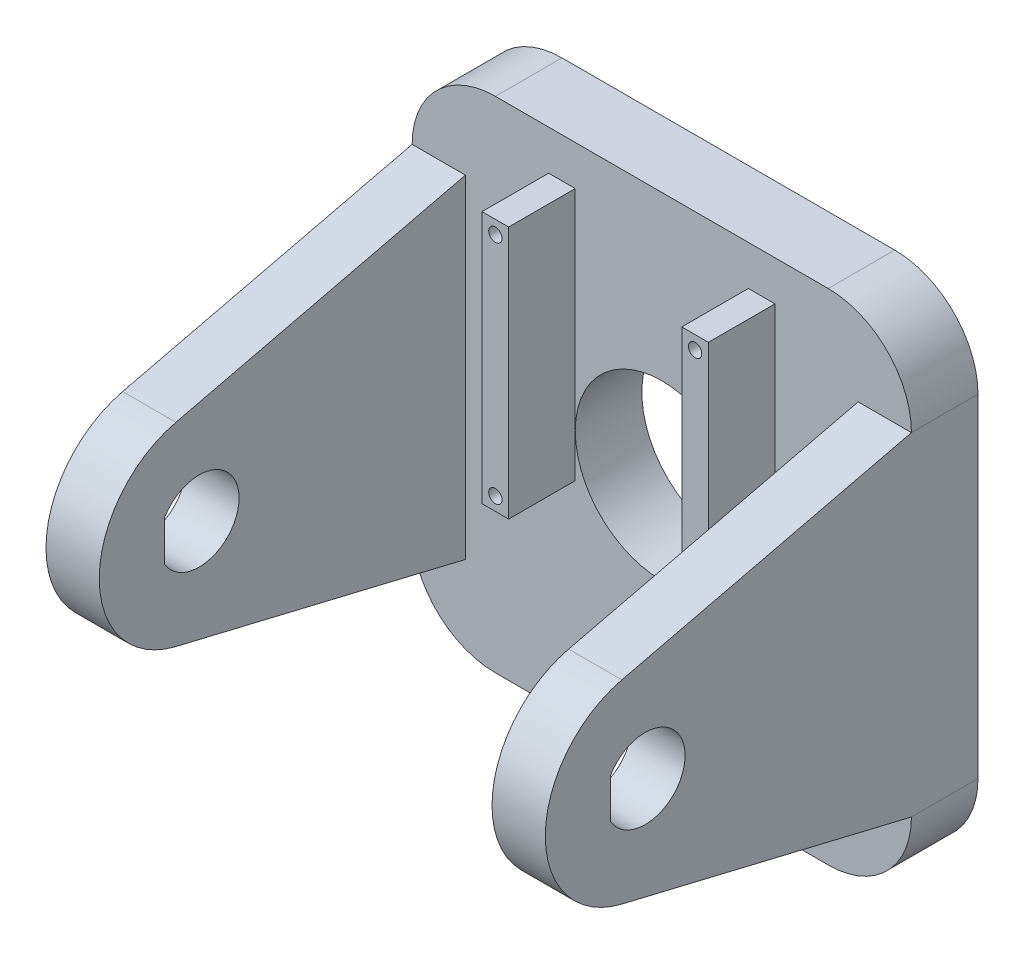
from build123d import *

# Parameters (mm, degrees)
BOSS_EXTRUDE1_DEPTH = 10
BOSS_EXTRUDE2_DEPTH = 8
SKETCH4_R           = 13
CUT_EXTRUDE2_DEPTH  = 77.40353395
SKETCH5_W           = 4
SKETCH5_H           = 38
SKETCH5_R           = 1
BOSS_EXTRUDE3_DEPTH = 10


with BuildPart() as part:
    # Sketch1 → Boss-Extrude1 (new body)
    with BuildSketch(Plane(origin=(0, 0, 0), x_dir=(0, 1, 0), z_dir=(0, 0, 1))):
        with BuildLine():
            Line((-25, -37.5), (25, -37.5))
            ThreePointArc((25, -37.5), (33.838834765, -33.838834765), (37.5, -25))
            Line((37.5, -25), (37.5, 25))
            ThreePointArc((37.5, 25), (33.838834765, 33.838834765), (25, 37.5))
            Line((25, 37.5), (-25, 37.5))
            ThreePointArc((-25, 37.5), (-33.838834765, 33.838834765), (-37.5, 25))
            Line((-37.5, 25), (-37.5, -25))
            ThreePointArc((-37.5, -25), (-33.838834765, -33.838834765), (-25, -37.5))
        make_face()
    extrude(amount=BOSS_EXTRUDE1_DEPTH)

    # Sketch2 → Boss-Extrude2 (add)
    with BuildSketch(Plane.YZ.offset(37.5)):
        with BuildLine():
            ThreePointArc((14.587782351, 53.492363969), (0, 65), (-14.587782351, 53.492363969))
            Line((-14.587782351, 53.492363969), (-25, 10))
            Line((-25, 10), (25, 10))
            Line((25, 10), (14.587782351, 53.492363969))
        make_face()
        with BuildLine():
            ThreePointArc((0, 44), (-5.795554958, 48.447085729), (-3, 55.196152423))
            Line((-3, 55.196152423), (3, 55.196152423))
            ThreePointArc((3, 55.196152423), (5.795554958, 48.447085729), (0, 44))
        make_face(mode=Mode.SUBTRACT)
    boss_extrude2 = extrude(amount=-BOSS_EXTRUDE2_DEPTH)

    # Mirror1: Boss-Extrude2 across plane
    add(boss_extrude2.mirror(Plane(origin=(0, 0, 0), x_dir=(0, 0, 1), z_dir=(1, 0, 0))))

    # Sketch4 → Cut-Extrude2 (cut, through all)
    with BuildSketch(Plane.XY.offset(10)):
        Circle(SKETCH4_R)
    extrude(amount=-CUT_EXTRUDE2_DEPTH, mode=Mode.SUBTRACT)

    # Sketch5 → Boss-Extrude3 (add)
    # profile 1 of 2: a face of its own
    with BuildSketch(Plane.XY.offset(10)):
        with Locations((-15, 12.5)):
            Rectangle(SKETCH5_W, SKETCH5_H)
        with Locations((-15, -4.5)):
            Circle(SKETCH5_R, mode=Mode.SUBTRACT)
        with Locations((-15, 29.5)):
            Circle(SKETCH5_R, mode=Mode.SUBTRACT)
    # profile 2 of 2: a face of its own
    with BuildSketch(Plane.XY.offset(10)):
        with Locations((15, 12.5)):
            Rectangle(SKETCH5_W, SKETCH5_H)
        with Locations((15, -4.5)):
            Circle(SKETCH5_R, mode=Mode.SUBTRACT)
        with Locations((15, 29.5)):
            Circle(SKETCH5_R, mode=Mode.SUBTRACT)
    extrude(amount=BOSS_EXTRUDE3_DEPTH)


solid = part.part
